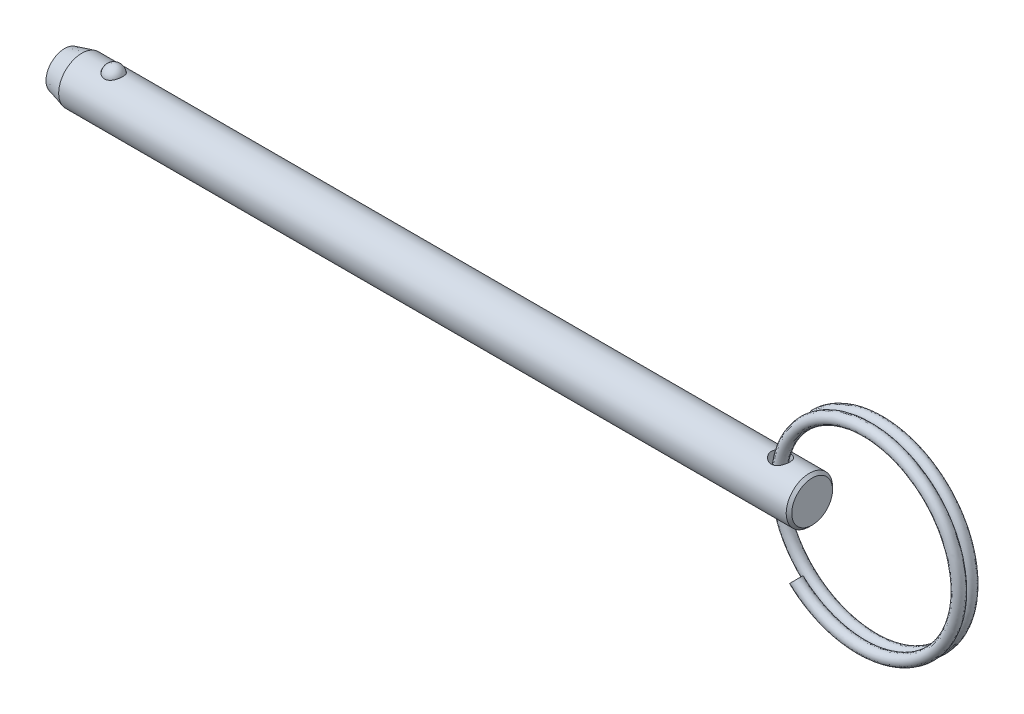
from build123d import *

# Parameters (mm, degrees)
SKETCH4_W          = 1.27
SKETCH4_H          = 6.35
SWEEP1_PITCH       = 1.5494
SWEEP1_HEIGHT      = 1.355725
SWEEP1_RADIUS      = 13.462
SKETCH6_R          = 0.762
SWEEP2_PITCH       = 1.5494
SWEEP2_HEIGHT      = 1.355725
SWEEP2_RADIUS      = 13.462
SWEEP2_START_ANGLE = -180
SKETCH6_2_R        = 0.762


with BuildPart() as part:
    # Sketch1 → Revolve1 (revolve)
    with BuildSketch(Plane.XY, mode=Mode.PRIVATE) as revolve1_sk:
        Polygon((5.588, 2.794), (5.207, 3.175), (-94.454947737, 3.175), (-96.8248, 2.54), (-96.8248, 0), (5.588, 0), align=None)
    revolve(revolve1_sk.sketch.rotate(Axis((5.588, 0, 0), (1, 0, 0)), 90), axis=Axis((5.588, 0, 0), (1, 0, 0)))

    # Sketch2 → Cut-Revolve1 (revolve, cut)
    with BuildSketch(Plane.XY):
        with BuildLine():
            Line((-88.832982051, 2.8575), (-91.347582051, 2.8575))
            ThreePointArc((-91.347582051, 2.8575), (-90.090282051, 4.1148), (-88.832982051, 2.8575))
        make_face()
    revolve(axis=Axis((-88.832982051, 2.8575, 0), (1, 0, 0)), mode=Mode.SUBTRACT)

    # Sketch4 → Cut-Revolve2 (revolve, cut)
    with BuildSketch(Plane.XY, mode=Mode.PRIVATE) as cut_revolve2_sk:
        with Locations((1.905, 0)):
            Rectangle(SKETCH4_W, SKETCH4_H)
    revolve(cut_revolve2_sk.sketch.rotate(Axis((1.27, -3.175, 0), (0, 1, 0)), 90), axis=Axis((1.27, -3.175, 0), (0, 1, 0)), mode=Mode.SUBTRACT)


with BuildPart() as body_2:
    # Sketch3 → Revolve2 (revolve)
    with BuildSketch(Plane.XY):
        with BuildLine():
            Line((-88.858382051, 2.8575), (-91.322182051, 2.8575))
            ThreePointArc((-91.322182051, 2.8575), (-90.090282051, 4.0894), (-88.858382051, 2.8575))
        make_face()
    revolve(axis=Axis((-88.858382051, 2.8575, 0), (1, 0, 0)))


with BuildPart() as body_3:
    # Sweep1: sweep along a helix
    with BuildLine() as sweep1_path:
        Helix(SWEEP1_PITCH, SWEEP1_HEIGHT, SWEEP1_RADIUS, center=(13.755025091, 0, 0), direction=(0, 0, -1), lefthand=True)
    # Sketch6 → Sweep1 (sweep)
    with BuildSketch(Plane(origin=(114.003847968, 0, 0), x_dir=(0, 0, -1), z_dir=(0, 1, 0))):
        with Locations((0, 112.948822877)):
            Circle(SKETCH6_R)
    sweep(path=sweep1_path.line, is_frenet=True)

    # Sweep2: sweep along a helix
    with BuildLine() as sweep2_path:
        add(Helix(SWEEP2_PITCH, SWEEP2_HEIGHT, SWEEP2_RADIUS, center=(13.755025091, 0, 0), direction=(0, 0, 1), lefthand=True, mode=Mode.PRIVATE).rotate(Axis((13.755025091, 0, 0), (0, 0, 1)), SWEEP2_START_ANGLE))
    # Sketch6<2> → Sweep2 (sweep)
    with BuildSketch(Plane(origin=(114.003847968, 0, 0), x_dir=(0, 0, -1), z_dir=(0, 1, 0))):
        with Locations((0, 112.948822877)):
            Circle(SKETCH6_2_R)
    sweep(path=sweep2_path.line, is_frenet=True)


solid = Compound([part.part, body_2.part, body_3.part])
